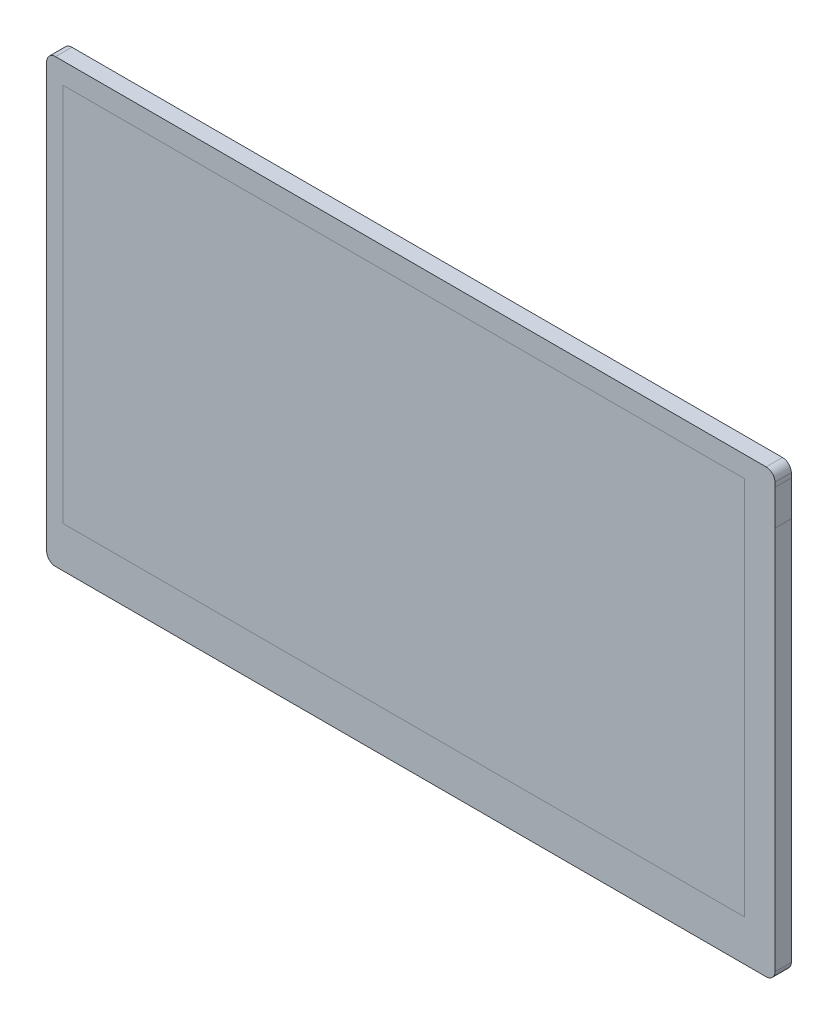
from build123d import *

# Parameters (mm, degrees)
SKETCH1_W           = 154.2144
SKETCH1_H           = 85.92
LCD_AA_DEPTH        = 3.7
SKETCH2_W           = 164.86
SKETCH2_H           = 99.96
SKETCH2_W_2         = 154.2144
SKETCH2_H_2         = 85.92
BOSS_EXTRUDE2_DEPTH = 3.7
FILLET1_R           = 2


with BuildPart() as part:
    # Sketch1 → LCD AA (new body)
    with BuildSketch(Plane.XY):
        Rectangle(SKETCH1_W, SKETCH1_H)
    extrude(amount=LCD_AA_DEPTH)


with BuildPart() as body_2:
    # Sketch2 → Boss-Extrude2 (new, through all)
    with BuildSketch(Plane.XY.offset(3.7)):
        with Locations((1.6028, -2.27)):
            Rectangle(SKETCH2_W, SKETCH2_H)
        Rectangle(SKETCH2_W_2, SKETCH2_H_2, mode=Mode.SUBTRACT)
    extrude(amount=-BOSS_EXTRUDE2_DEPTH)

    # Fillet1
    fillet1_edges = [body_2.edges().sort_by_distance(p)[0] for p in [
        (-80.8272, 47.71, 1.85),
        (84.0328, 47.71, 1.85),
        (84.0328, -52.25, 1.85),
        (-80.8272, -52.25, 1.85),
    ]]
    fillet(fillet1_edges, radius=FILLET1_R)


solid = Compound([part.part, body_2.part])
